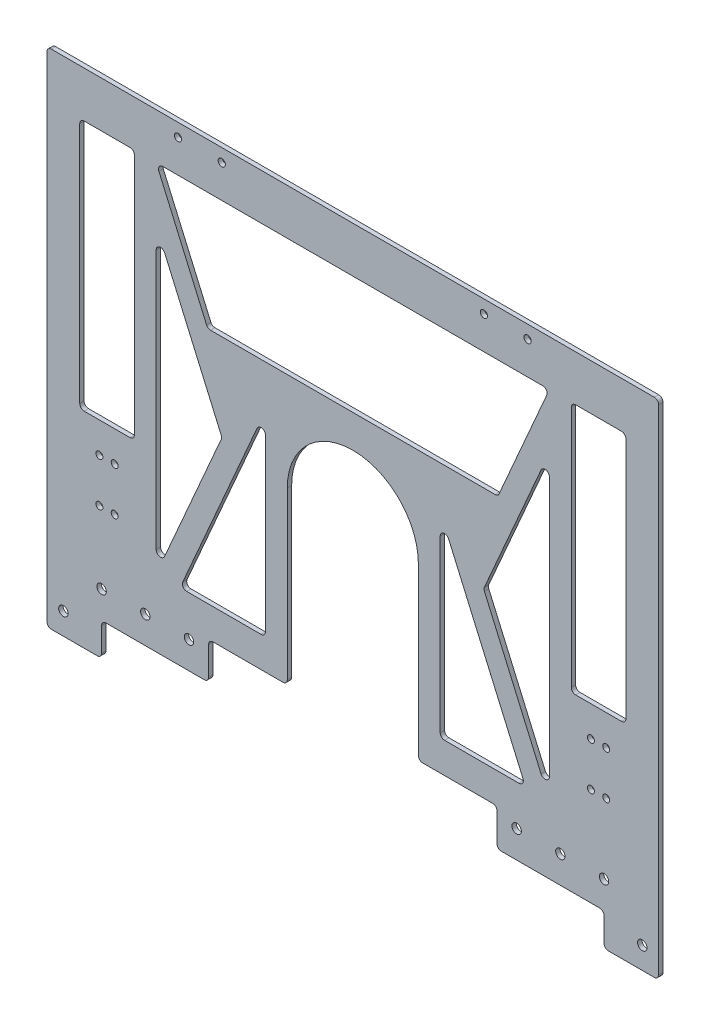
from build123d import *

# Parameters (mm, degrees)
SKETCH_1_W          = 280
SKETCH_1_H          = 230
EXTRUDE_1_DEPTH     = 2
SKETCH_2_R          = 2.15
CUT_EXTRUDE_1_DEPTH = 182.18774793
SKETCH_3_R          = 30
CUT_EXTRUDE_2_DEPTH = 182.18774793
SKETCH_4_R          = 1.6
CUT_EXTRUDE_3_DEPTH = 182.18774793
SKETCH_5_R          = 1.65
CUT_EXTRUDE_4_DEPTH = 182.18774793
SKETCH_7_W          = 25
SKETCH_7_H          = 115
SKETCH_7_W_2        = 85
SKETCH_7_H_2        = 15
CUT_EXTRUDE_5_DEPTH = 182.18774793
SKETCH_9_W          = 36
SKETCH_9_H          = 17
CUT_EXTRUDE_6_DEPTH = 182.18774793
FILLET_1_R          = 2
FILLET_2_R          = 2


with BuildPart() as part:
    # 草图1 → 凸台-拉伸1 (new body)
    with BuildSketch(Plane.XY):
        Rectangle(SKETCH_1_W, SKETCH_1_H)
    extrude(amount=EXTRUDE_1_DEPTH)

    # 草图2 → 切除-拉伸1 (cut, through all)
    with BuildSketch(Plane.XY.offset(2)):
        with Locations((-132.5, -105)):
            Circle(SKETCH_2_R)
        with Locations(Location((132.5, -105, 0), (0, 0, 180))):
            Circle(SKETCH_2_R)
        with Locations((-115, -87.5)):
            Circle(SKETCH_2_R)
        with Locations((-95, -87.5)):
            Circle(SKETCH_2_R)
        with Locations((-75, -87.5)):
            Circle(SKETCH_2_R)
        with Locations(Location((75, -87.5, 0), (0, 0, 180))):
            Circle(SKETCH_2_R)
        with Locations(Location((95, -87.5, 0), (0, 0, 180))):
            Circle(SKETCH_2_R)
        with Locations(Location((115, -87.5, 0), (0, 0, 180))):
            Circle(SKETCH_2_R)
    extrude(amount=-CUT_EXTRUDE_1_DEPTH, mode=Mode.SUBTRACT)

    # 草图3 → 切除-拉伸2 (cut, through all)
    with BuildSketch(Plane.XY.offset(2)):
        with Locations((0, -5)):
            Circle(SKETCH_3_R)
        with BuildLine():
            ThreePointArc((30, -5), (0, -35), (-30, -5))
            Line((-30, -5), (-30, -115))
            Line((-30, -115), (30, -115))
            Line((30, -115), (30, -5))
        make_face()
    extrude(amount=-CUT_EXTRUDE_2_DEPTH, mode=Mode.SUBTRACT)

    # 草图4 → 切除-拉伸3 (cut, through all)
    with BuildSketch(Plane.XY.offset(2)):
        with Locations((-109, -35)):
            Circle(SKETCH_4_R)
        with Locations((-109, -55)):
            Circle(SKETCH_4_R)
        with Locations((-116, -35)):
            Circle(SKETCH_4_R)
        with Locations((-116, -55)):
            Circle(SKETCH_4_R)
        with Locations(Location((116, -55, 0), (0, 0, 180))):
            Circle(SKETCH_4_R)
        with Locations(Location((116, -35, 0), (0, 0, 180))):
            Circle(SKETCH_4_R)
        with Locations(Location((109, -55, 0), (0, 0, 180))):
            Circle(SKETCH_4_R)
        with Locations(Location((109, -35, 0), (0, 0, 180))):
            Circle(SKETCH_4_R)
    extrude(amount=-CUT_EXTRUDE_3_DEPTH, mode=Mode.SUBTRACT)

    # 草图5 → 切除-拉伸4 (cut, through all)
    with BuildSketch(Plane.XY.offset(2)):
        with Locations((-60, 109)):
            Circle(SKETCH_5_R)
        with Locations((-80, 109)):
            Circle(SKETCH_5_R)
        with Locations(Location((80, 109, 0), (0, 0, 180))):
            Circle(SKETCH_5_R)
        with Locations(Location((60, 109, 0), (0, 0, 180))):
            Circle(SKETCH_5_R)
    extrude(amount=-CUT_EXTRUDE_4_DEPTH, mode=Mode.SUBTRACT)

    # 草图7 → 切除-拉伸5 (cut, through all)
    with BuildSketch(Plane.XY.offset(2)):
        Polygon((-90, 69), (-90, -69), (-59.885931147, 0), align=None)
        Polygon((-90, 94), (-66.432467855, 40), (66.432467855, 40), (90, 94), align=None)
        Polygon((-40, 20.564392374), (-79.089105488, -69), (-40, -69), align=None)
        Polygon((40, -69), (40, 20.564392374), (79.089105488, -69), align=None)
        Polygon((59.885931147, 0), (90, 69), (90, -69), align=None)
        with Locations((112.5, 36.5)):
            Rectangle(SKETCH_7_W, SKETCH_7_H)
        with Locations((-112.5, 36.5)):
            Rectangle(SKETCH_7_W, SKETCH_7_H)
        with Locations((72.5, -107.5)):
            Rectangle(SKETCH_7_W_2, SKETCH_7_H_2)
        with Locations((-72.5, -107.5)):
            Rectangle(SKETCH_7_W_2, SKETCH_7_H_2)
    extrude(amount=-CUT_EXTRUDE_5_DEPTH, mode=Mode.SUBTRACT)

    # 草图9 → 切除-拉伸6 (cut, through all)
    with BuildSketch(Plane.XY.offset(2)):
        with Locations((48, -91.5)):
            Rectangle(SKETCH_9_W, SKETCH_9_H)
        with Locations((-48, -91.5)):
            Rectangle(SKETCH_9_W, SKETCH_9_H)
    extrude(amount=-CUT_EXTRUDE_6_DEPTH, mode=Mode.SUBTRACT)

    # 圆角1
    fillet_1_edges = [part.edges().sort_by_distance(p)[0] for p in [
        (79.089105488, -69, 1),
        (40, -69, 1),
        (40, 20.564392374, 1),
        (-40, -69, 1),
        (-79.089105488, -69, 1),
        (-40, 20.564392374, 1),
        (66.432467855, 40, 1),
        (-66.432467855, 40, 1),
        (-90, 94, 1),
        (90, 94, 1),
        (-125, -21, 1),
        (-125, 94, 1),
        (-100, 94, 1),
        (-100, -21, 1),
        (90, -69, 1),
        (59.885931147, 0, 1),
        (90, 69, 1),
        (100, 94, 1),
        (125, 94, 1),
        (125, -21, 1),
        (100, -21, 1),
        (-90, 69, 1),
        (-59.885931147, 0, 1),
        (-90, -69, 1),
    ]]
    fillet(fillet_1_edges, radius=FILLET_1_R)

    # 圆角2
    fillet_2_edges = [part.edges().sort_by_distance(p)[0] for p in [
        (115, -115, 1),
        (115, -100, 1),
        (-115, -115, 1),
        (-115, -100, 1),
        (-30, -83, 1),
        (-66, -100, 1),
        (-66, -83, 1),
        (66, -100, 1),
        (30, -83, 1),
        (66, -83, 1),
        (140, -115, 1),
        (-140, -115, 1),
        (-140, 115, 1),
        (140, 115, 1),
    ]]
    fillet(fillet_2_edges, radius=FILLET_2_R)


solid = part.part
